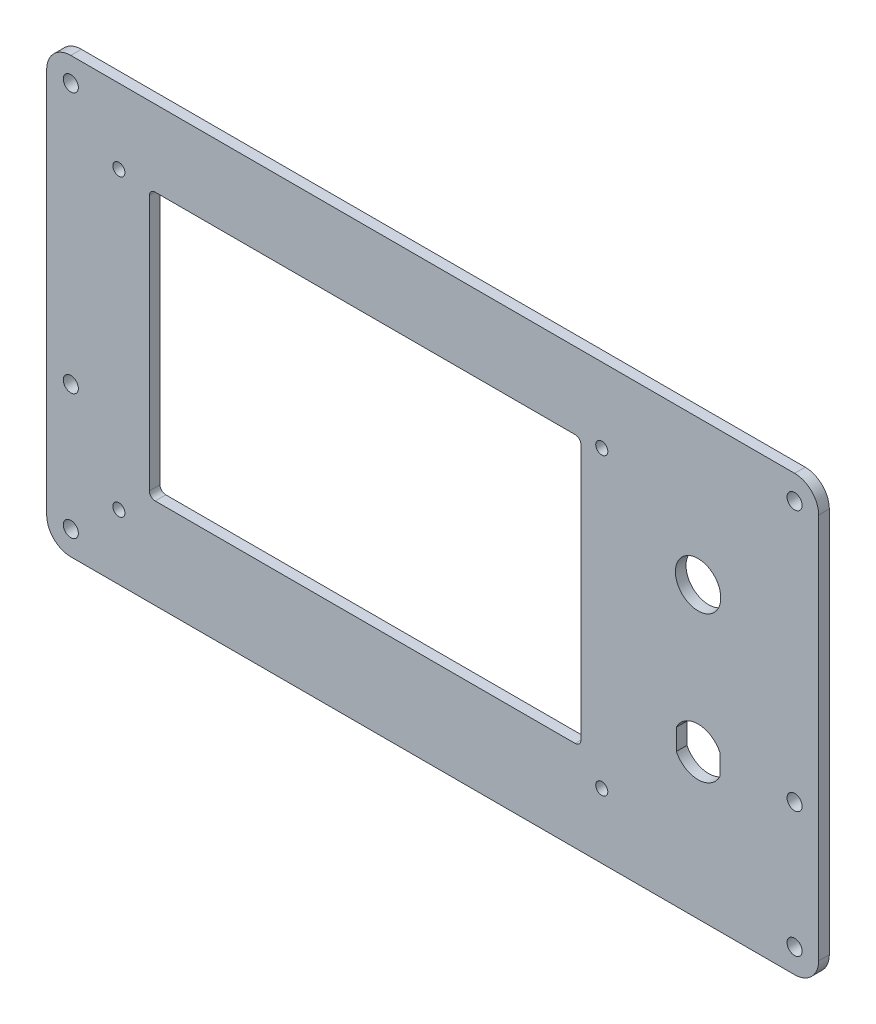
from build123d import *

# Parameters (mm, degrees)
SKETCH1_W                       = 203.2
SKETCH1_H                       = 114.3
BOSS_EXTRUDE1_DEPTH             = 2.794
F_1_8_0_125_DIAMETER_HOLE1_D    = 3.175
F_5_32_0_15625_DIAMETER_HOLE1_D = 3.96875
SKETCH4_W                       = 113.5879999
SKETCH4_H                       = 70.38799994
CUT_EXTRUDE1_DEPTH              = 117.603983362
FILLET1_R                       = 1.524
FILLET2_R                       = 6.35
SKETCH7_R                       = 5.969
CUT_EXTRUDE2_DEPTH              = 117.603983362


with BuildPart() as part:
    # Sketch1 → Boss-Extrude1 (new body)
    with BuildSketch(Plane.XY):
        Rectangle(SKETCH1_W, SKETCH1_H)
    extrude(amount=BOSS_EXTRUDE1_DEPTH)

    # 1/8 (0.125) Diameter Hole1 (through all)
    with Locations(Plane.XY.offset(2.794)):
        with Locations((-82.6, -40.07), (-82.6, 37.53), (44.5, -40.07), (44.5, 37.53)):
            Hole(F_1_8_0_125_DIAMETER_HOLE1_D / 2)

    # 5/32 (0.15625) Diameter Hole1 (through all)
    with Locations(Plane.XY.offset(2.794)):
        with Locations((95.25, -17.78), (-95.25, 50.8), (95.25, 50.8), (95.25, -50.8), (-95.25, -50.8), (-95.25, -17.78)):
            Hole(F_5_32_0_15625_DIAMETER_HOLE1_D / 2)

    # Sketch4 → Cut-Extrude1 (cut, through all)
    with BuildSketch(Plane.XY.offset(2.794)):
        with Locations((-17.78, 1.89000003)):
            Rectangle(SKETCH4_W, SKETCH4_H)
    extrude(amount=-CUT_EXTRUDE1_DEPTH, mode=Mode.SUBTRACT)

    # Fillet1
    fillet1_edges = [part.edges().sort_by_distance(p)[0] for p in [
        (39.01399995, 37.084, 1.397),
        (39.01399995, -33.30399994, 1.397),
        (-74.57399995, -33.30399994, 1.397),
        (-74.57399995, 37.084, 1.397),
    ]]
    fillet(fillet1_edges, radius=FILLET1_R)

    # Fillet2
    fillet2_edges = [part.edges().sort_by_distance(p)[0] for p in [
        (101.6, -57.15, 1.397),
        (-101.6, -57.15, 1.397),
        (-101.6, 57.15, 1.397),
        (101.6, 57.15, 1.397),
    ]]
    fillet(fillet2_edges, radius=FILLET2_R)

    # Sketch7 → Cut-Extrude2 (cut, through all)
    with BuildSketch(Plane.XY.offset(2.794)):
        with Locations((69.85, 19.05)):
            Circle(SKETCH7_R)
        with BuildLine():
            Line((64.135, -21.817900829), (64.135, -16.282099171))
            ThreePointArc((64.135, -16.282099171), (69.85, -12.7), (75.565, -16.282099171))
            Line((75.565, -16.282099171), (75.565, -21.817900829))
            ThreePointArc((75.565, -21.817900829), (69.85, -25.4), (64.135, -21.817900829))
        make_face()
    extrude(amount=-CUT_EXTRUDE2_DEPTH, mode=Mode.SUBTRACT)


solid = part.part
